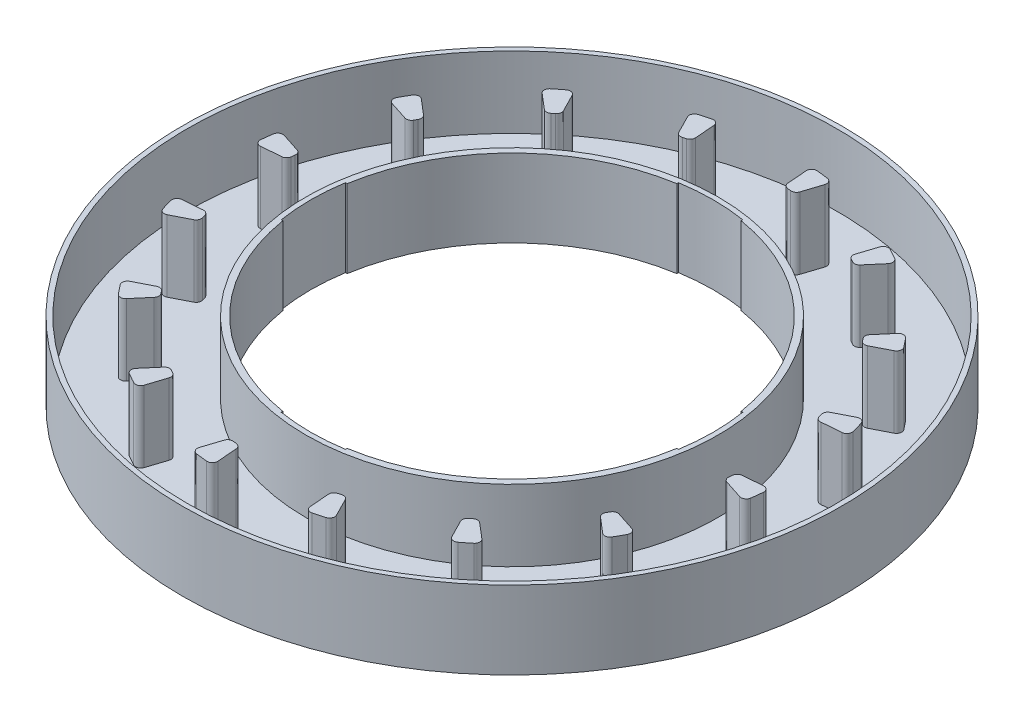
from build123d import *

# Parameters (mm, degrees)
SKETCH1_R               = 101.5
SKETCH1_R_2             = 61.5
BOSS_EXTRUDE1_DEPTH     = 2
SKETCH2_R               = 101.5
SKETCH2_R_2             = 100
SKETCH2_R_3             = 63.5
SKETCH2_R_4             = 61.5
BOSS_EXTRUDE2_DEPTH     = 22
CUT_EXTRUDE1_DEPTH      = 146.535219105
CUT_EXTRUDE1_DEPTH_BACK = 146.535219105
BOSS_EXTRUDE3_DEPTH     = 22


with BuildPart() as part:
    # Sketch1 → Boss-Extrude1 (new body)
    with BuildSketch(Plane(origin=(0, 0, 0), x_dir=(1, 0, 0), z_dir=(0, 1, 0))):
        with Locations(Location((0, 0, 0), (0, 0, 270))):
            Circle(SKETCH1_R)
        with Locations(Location((0, 0, 0), (0, 0, 270))):
            Circle(SKETCH1_R_2, mode=Mode.SUBTRACT)
    extrude(amount=BOSS_EXTRUDE1_DEPTH)

    # Sketch2 → Boss-Extrude2 (add)
    # profile 1 of 2: a face of its own
    with BuildSketch(Plane(origin=(0, 2, 0), x_dir=(1, 0, 0), z_dir=(0, 1, 0))):
        with Locations(Location((0, 0, 0), (0, 0, 270))):
            Circle(SKETCH2_R)
        with Locations(Location((0, 0, 0), (0, 0, 270))):
            Circle(SKETCH2_R_2, mode=Mode.SUBTRACT)
    # profile 2 of 2: a face of its own
    with BuildSketch(Plane(origin=(0, 2, 0), x_dir=(1, 0, 0), z_dir=(0, 1, 0))):
        with Locations(Location((0, 0, 0), (0, 0, 270))):
            Circle(SKETCH2_R_3)
        with Locations(Location((0, 0, 0), (0, 0, 270))):
            Circle(SKETCH2_R_4, mode=Mode.SUBTRACT)
    extrude(amount=BOSS_EXTRUDE2_DEPTH)

    # Sketch3 → Cut-Extrude1 (cut, two sides: drawn at the far end of the back side and taken through both)
    with BuildSketch(Plane.XZ.offset(-CUT_EXTRUDE1_DEPTH_BACK)):
        with BuildLine():
            Line((-9.848477804, 60.706321623), (-9.956697611, 61.194469626))
            ThreePointArc((-9.956697611, 61.194469626), (0, 61.999184996), (9.956697611, 61.194469626))
            Line((9.956697611, 61.194469626), (9.848477804, 60.706321623))
            ThreePointArc((9.848477804, 60.706321623), (0, 61.5), (-9.848477804, 60.706321623))
        make_face()
        with BuildLine():
            Line((60.706321623, -9.848477804), (61.194469626, -9.956697611))
            ThreePointArc((61.194469626, -9.956697611), (61.999184996, 0), (61.194469626, 9.956697611))
            Line((61.194469626, 9.956697611), (60.706321623, 9.848477804))
            ThreePointArc((60.706321623, 9.848477804), (61.5, 0), (60.706321623, -9.848477804))
        make_face()
        with BuildLine():
            Line((-9.848477804, -60.706321623), (-9.956697611, -61.194469626))
            ThreePointArc((-9.956697611, -61.194469626), (0, -61.999184996), (9.956697611, -61.194469626))
            Line((9.956697611, -61.194469626), (9.848477804, -60.706321623))
            ThreePointArc((9.848477804, -60.706321623), (0, -61.5), (-9.848477804, -60.706321623))
        make_face()
        with BuildLine():
            Line((-60.706321623, 9.848477804), (-61.194469626, 9.956697611))
            ThreePointArc((-61.194469626, 9.956697611), (-61.999184996, 0), (-61.194469626, -9.956697611))
            Line((-61.194469626, -9.956697611), (-60.706321623, -9.848477804))
            ThreePointArc((-60.706321623, -9.848477804), (-61.5, 0), (-60.706321623, 9.848477804))
        make_face()
    extrude(amount=CUT_EXTRUDE1_DEPTH + CUT_EXTRUDE1_DEPTH_BACK, mode=Mode.SUBTRACT)

    # Sketch4 → Boss-Extrude3 (add)
    with BuildSketch(Plane(origin=(0, 2, 0), x_dir=(1, 0, 0), z_dir=(0, 1, 0))):
        with BuildLine():
            ThreePointArc((9.498467265, 76.339011525), (8.981474223, 76.401597998), (8.464061247, 76.460612267))
            ThreePointArc((8.464061247, 76.460612267), (7.491236131, 76.937097552), (7.044917122, 77.924126567))
            Line((7.044917122, 77.924126567), (6.561413147, 84.00614048))
            ThreePointArc((6.561413147, 84.00614048), (7.034632785, 85.273848412), (8.310174258, 85.725527699))
            ThreePointArc((8.310174258, 85.725527699), (10.055593983, 85.538679957), (11.796761223, 85.315658118))
            ThreePointArc((11.796761223, 85.315658118), (12.932780961, 84.58048509), (13.0991088, 83.237594448))
            Line((13.0991088, 83.237594448), (11.218322267, 77.433517317))
            ThreePointArc((11.218322267, 77.433517317), (10.555271552, 76.576901484), (9.498467265, 76.339011525))
        make_face()
        with BuildLine():
            ThreePointArc((-20.438235457, 74.162956335), (-20.939825553, 74.022934025), (-21.440436594, 73.879450726))
            ThreePointArc((-21.440436594, 73.879450726), (-22.521552833, 73.947381674), (-23.311617481, 74.688478689))
            Line((-23.311617481, 74.688478689), (-26.085802867, 80.122497899))
            ThreePointArc((-26.085802867, 80.122497899), (-26.133735752, 81.474800626), (-25.128139273, 82.380226464))
            ThreePointArc((-25.128139273, 82.380226464), (-23.444078178, 82.875544871), (-21.750102639, 83.335815414))
            ThreePointArc((-21.750102639, 83.335815414), (-20.419218717, 83.091340032), (-19.75164983, 81.914321762))
            Line((-19.75164983, 81.914321762), (-19.268145855, 75.83230785))
            ThreePointArc((-19.268145855, 75.83230785), (-19.552912152, 74.787159491), (-20.438235457, 74.162956335))
        make_face()
        with BuildLine():
            ThreePointArc((-47.263402104, 60.696263332), (-47.673226709, 60.374949366), (-48.080822323, 60.050812532))
            ThreePointArc((-48.080822323, 60.050812532), (-49.105639536, 59.699847271), (-50.119169644, 60.082186984))
            Line((-50.119169644, 60.082186984), (-54.761691864, 64.040931325))
            ThreePointArc((-54.761691864, 64.040931325), (-55.323479924, 65.271953015), (-54.740921386, 66.493282527))
            ThreePointArc((-54.740921386, 66.493282527), (-53.374601957, 67.595359346), (-51.98571054, 68.668850254))
            ThreePointArc((-51.98571054, 68.668850254), (-50.662577446, 68.95229168), (-49.595398823, 68.120336144))
            Line((-49.595398823, 68.120336144), (-46.821213437, 62.686316934))
            ThreePointArc((-46.821213437, 62.686316934), (-46.68434223, 61.611750414), (-47.263402104, 60.696263332))
        make_face()
        with BuildLine():
            ThreePointArc((-66.893144225, 37.98911445), (-67.148811258, 37.535425967), (-67.401338706, 37.079982491))
            ThreePointArc((-67.401338706, 37.079982491), (-68.213837764, 36.363552302), (-69.296532559, 36.328926956))
            Line((-69.296532559, 36.328926956), (-75.10060969, 38.20971349))
            ThreePointArc((-75.10060969, 38.20971349), (-76.090725786, 39.13204225), (-76.019894447, 40.48333909))
            ThreePointArc((-76.019894447, 40.48333909), (-75.179326431, 42.024393115), (-74.306965263, 43.547675127))
            ThreePointArc((-74.306965263, 43.547675127), (-73.193018016, 44.315881973), (-71.888697929, 43.95564686))
            Line((-71.888697929, 43.95564686), (-67.246175709, 39.996902518))
            ThreePointArc((-67.246175709, 39.996902518), (-66.708504397, 39.056510847), (-66.893144225, 37.98911445))
        make_face()
        with BuildLine():
            ThreePointArc((60.696263332, 47.263402104), (60.374949366, 47.673226709), (60.050812532, 48.080822323))
            ThreePointArc((60.050812532, 48.080822323), (59.699847271, 49.105639536), (60.082186984, 50.119169644))
            Line((60.082186984, 50.119169644), (64.040931325, 54.761691864))
            ThreePointArc((64.040931325, 54.761691864), (65.271953015, 55.323479924), (66.493282527, 54.740921386))
            ThreePointArc((66.493282527, 54.740921386), (67.595359346, 53.374601957), (68.668850254, 51.98571054))
            ThreePointArc((68.668850254, 51.98571054), (68.95229168, 50.662577446), (68.120336144, 49.595398823))
            Line((68.120336144, 49.595398823), (62.686316934, 46.821213437))
            ThreePointArc((62.686316934, 46.821213437), (61.611750414, 46.68434223), (60.696263332, 47.263402104))
        make_face()
        with BuildLine():
            ThreePointArc((74.162956335, 20.438235457), (74.022934025, 20.939825553), (73.879450726, 21.440436594))
            ThreePointArc((73.879450726, 21.440436594), (73.947381674, 22.521552833), (74.688478689, 23.311617481))
            Line((74.688478689, 23.311617481), (80.122497899, 26.085802867))
            ThreePointArc((80.122497899, 26.085802867), (81.474800626, 26.133735752), (82.380226464, 25.128139273))
            ThreePointArc((82.380226464, 25.128139273), (82.875544871, 23.444078178), (83.335815414, 21.750102639))
            ThreePointArc((83.335815414, 21.750102639), (83.091340032, 20.419218717), (81.914321762, 19.75164983))
            Line((81.914321762, 19.75164983), (75.83230785, 19.268145855))
            ThreePointArc((75.83230785, 19.268145855), (74.787159491, 19.552912152), (74.162956335, 20.438235457))
        make_face()
        with BuildLine():
            ThreePointArc((-74.162956335, -20.438235457), (-74.022934025, -20.939825553), (-73.879450726, -21.440436594))
            ThreePointArc((-73.879450726, -21.440436594), (-73.947381674, -22.521552833), (-74.688478689, -23.311617481))
            Line((-74.688478689, -23.311617481), (-80.122497899, -26.085802867))
            ThreePointArc((-80.122497899, -26.085802867), (-81.474800626, -26.133735752), (-82.380226464, -25.128139273))
            ThreePointArc((-82.380226464, -25.128139273), (-82.875544871, -23.444078178), (-83.335815414, -21.750102639))
            ThreePointArc((-83.335815414, -21.750102639), (-83.091340032, -20.419218717), (-81.914321762, -19.75164983))
            Line((-81.914321762, -19.75164983), (-75.83230785, -19.268145855))
            ThreePointArc((-75.83230785, -19.268145855), (-74.787159491, -19.552912152), (-74.162956335, -20.438235457))
        make_face()
        with BuildLine():
            ThreePointArc((-60.696263332, -47.263402104), (-60.374949366, -47.673226709), (-60.050812532, -48.080822323))
            ThreePointArc((-60.050812532, -48.080822323), (-59.699847271, -49.105639536), (-60.082186984, -50.119169644))
            Line((-60.082186984, -50.119169644), (-64.040931325, -54.761691864))
            ThreePointArc((-64.040931325, -54.761691864), (-65.271953015, -55.323479924), (-66.493282527, -54.740921386))
            ThreePointArc((-66.493282527, -54.740921386), (-67.595359346, -53.374601957), (-68.668850254, -51.98571054))
            ThreePointArc((-68.668850254, -51.98571054), (-68.95229168, -50.662577446), (-68.120336144, -49.595398823))
            Line((-68.120336144, -49.595398823), (-62.686316934, -46.821213437))
            ThreePointArc((-62.686316934, -46.821213437), (-61.611750414, -46.68434223), (-60.696263332, -47.263402104))
        make_face()
        with BuildLine():
            ThreePointArc((76.339011525, -9.498467265), (76.401597998, -8.981474223), (76.460612267, -8.464061247))
            ThreePointArc((76.460612267, -8.464061247), (76.937097552, -7.491236131), (77.924126567, -7.044917122))
            Line((77.924126567, -7.044917122), (84.00614048, -6.561413147))
            ThreePointArc((84.00614048, -6.561413147), (85.273848412, -7.034632785), (85.725527699, -8.310174258))
            ThreePointArc((85.725527699, -8.310174258), (85.538679957, -10.055593983), (85.315658118, -11.796761223))
            ThreePointArc((85.315658118, -11.796761223), (84.58048509, -12.932780961), (83.237594448, -13.0991088))
            Line((83.237594448, -13.0991088), (77.433517317, -11.218322267))
            ThreePointArc((77.433517317, -11.218322267), (76.576901484, -10.555271552), (76.339011525, -9.498467265))
        make_face()
        with BuildLine():
            ThreePointArc((66.893144225, -37.98911445), (67.148811258, -37.535425967), (67.401338706, -37.079982491))
            ThreePointArc((67.401338706, -37.079982491), (68.213837764, -36.363552302), (69.296532559, -36.328926956))
            Line((69.296532559, -36.328926956), (75.10060969, -38.20971349))
            ThreePointArc((75.10060969, -38.20971349), (76.090725786, -39.13204225), (76.019894447, -40.48333909))
            ThreePointArc((76.019894447, -40.48333909), (75.179326431, -42.024393115), (74.306965263, -43.547675127))
            ThreePointArc((74.306965263, -43.547675127), (73.193018016, -44.315881973), (71.888697929, -43.95564686))
            Line((71.888697929, -43.95564686), (67.246175709, -39.996902518))
            ThreePointArc((67.246175709, -39.996902518), (66.708504397, -39.056510847), (66.893144225, -37.98911445))
        make_face()
        with BuildLine():
            ThreePointArc((-37.98911445, -66.893144225), (-37.535425967, -67.148811258), (-37.079982491, -67.401338706))
            ThreePointArc((-37.079982491, -67.401338706), (-36.363552302, -68.213837764), (-36.328926956, -69.296532559))
            Line((-36.328926956, -69.296532559), (-38.20971349, -75.10060969))
            ThreePointArc((-38.20971349, -75.10060969), (-39.13204225, -76.090725786), (-40.48333909, -76.019894447))
            ThreePointArc((-40.48333909, -76.019894447), (-42.024393115, -75.179326431), (-43.547675127, -74.306965263))
            ThreePointArc((-43.547675127, -74.306965263), (-44.315881973, -73.193018016), (-43.95564686, -71.888697929))
            Line((-43.95564686, -71.888697929), (-39.996902518, -67.246175709))
            ThreePointArc((-39.996902518, -67.246175709), (-39.056510847, -66.708504397), (-37.98911445, -66.893144225))
        make_face()
        with BuildLine():
            ThreePointArc((-9.498467265, -76.339011525), (-8.981474223, -76.401597998), (-8.464061247, -76.460612267))
            ThreePointArc((-8.464061247, -76.460612267), (-7.491236131, -76.937097552), (-7.044917122, -77.924126567))
            Line((-7.044917122, -77.924126567), (-6.561413147, -84.00614048))
            ThreePointArc((-6.561413147, -84.00614048), (-7.034632785, -85.273848412), (-8.310174258, -85.725527699))
            ThreePointArc((-8.310174258, -85.725527699), (-10.055593983, -85.538679957), (-11.796761223, -85.315658118))
            ThreePointArc((-11.796761223, -85.315658118), (-12.932780961, -84.58048509), (-13.0991088, -83.237594448))
            Line((-13.0991088, -83.237594448), (-11.218322267, -77.433517317))
            ThreePointArc((-11.218322267, -77.433517317), (-10.555271552, -76.576901484), (-9.498467265, -76.339011525))
        make_face()
        with BuildLine():
            ThreePointArc((20.438235457, -74.162956335), (20.939825553, -74.022934025), (21.440436594, -73.879450726))
            ThreePointArc((21.440436594, -73.879450726), (22.521552833, -73.947381674), (23.311617481, -74.688478689))
            Line((23.311617481, -74.688478689), (26.085802867, -80.122497899))
            ThreePointArc((26.085802867, -80.122497899), (26.133735752, -81.474800626), (25.128139273, -82.380226464))
            ThreePointArc((25.128139273, -82.380226464), (23.444078178, -82.875544871), (21.750102639, -83.335815414))
            ThreePointArc((21.750102639, -83.335815414), (20.419218717, -83.091340032), (19.75164983, -81.914321762))
            Line((19.75164983, -81.914321762), (19.268145855, -75.83230785))
            ThreePointArc((19.268145855, -75.83230785), (19.552912152, -74.787159491), (20.438235457, -74.162956335))
        make_face()
        with BuildLine():
            ThreePointArc((43.95564686, 71.888697929), (44.315881973, 73.193018016), (43.547675127, 74.306965263))
            ThreePointArc((43.547675127, 74.306965263), (42.024393115, 75.179326431), (40.48333909, 76.019894447))
            ThreePointArc((40.48333909, 76.019894447), (39.13204225, 76.090725786), (38.20971349, 75.10060969))
            Line((38.20971349, 75.10060969), (36.328926956, 69.296532559))
            ThreePointArc((36.328926956, 69.296532559), (36.363552302, 68.213837764), (37.079982491, 67.401338706))
            ThreePointArc((37.079982491, 67.401338706), (37.535425967, 67.148811258), (37.98911445, 66.893144225))
            ThreePointArc((37.98911445, 66.893144225), (39.056510847, 66.708504397), (39.996902518, 67.246175709))
            Line((39.996902518, 67.246175709), (43.95564686, 71.888697929))
        make_face()
        with BuildLine():
            Line((-77.433517317, 11.218322267), (-83.237594448, 13.0991088))
            ThreePointArc((-83.237594448, 13.0991088), (-84.58048509, 12.932780961), (-85.315658118, 11.796761223))
            ThreePointArc((-85.315658118, 11.796761223), (-85.538679957, 10.055593983), (-85.725527699, 8.310174258))
            ThreePointArc((-85.725527699, 8.310174258), (-85.273848412, 7.034632785), (-84.00614048, 6.561413147))
            Line((-84.00614048, 6.561413147), (-77.924126567, 7.044917122))
            ThreePointArc((-77.924126567, 7.044917122), (-76.937097552, 7.491236131), (-76.460612267, 8.464061247))
            ThreePointArc((-76.460612267, 8.464061247), (-76.401597998, 8.981474223), (-76.339011525, 9.498467265))
            ThreePointArc((-76.339011525, 9.498467265), (-76.576901484, 10.555271552), (-77.433517317, 11.218322267))
        make_face()
        with BuildLine():
            Line((46.821213437, -62.686316934), (49.595398823, -68.120336144))
            ThreePointArc((49.595398823, -68.120336144), (50.662577446, -68.95229168), (51.98571054, -68.668850254))
            ThreePointArc((51.98571054, -68.668850254), (53.374601957, -67.595359346), (54.740921386, -66.493282527))
            ThreePointArc((54.740921386, -66.493282527), (55.323479924, -65.271953015), (54.761691864, -64.040931325))
            Line((54.761691864, -64.040931325), (50.119169644, -60.082186984))
            ThreePointArc((50.119169644, -60.082186984), (49.105639536, -59.699847271), (48.080822323, -60.050812532))
            ThreePointArc((48.080822323, -60.050812532), (47.673226709, -60.374949366), (47.263402104, -60.696263332))
            ThreePointArc((47.263402104, -60.696263332), (46.68434223, -61.611750414), (46.821213437, -62.686316934))
        make_face()
    extrude(amount=BOSS_EXTRUDE3_DEPTH)


solid = part.part
